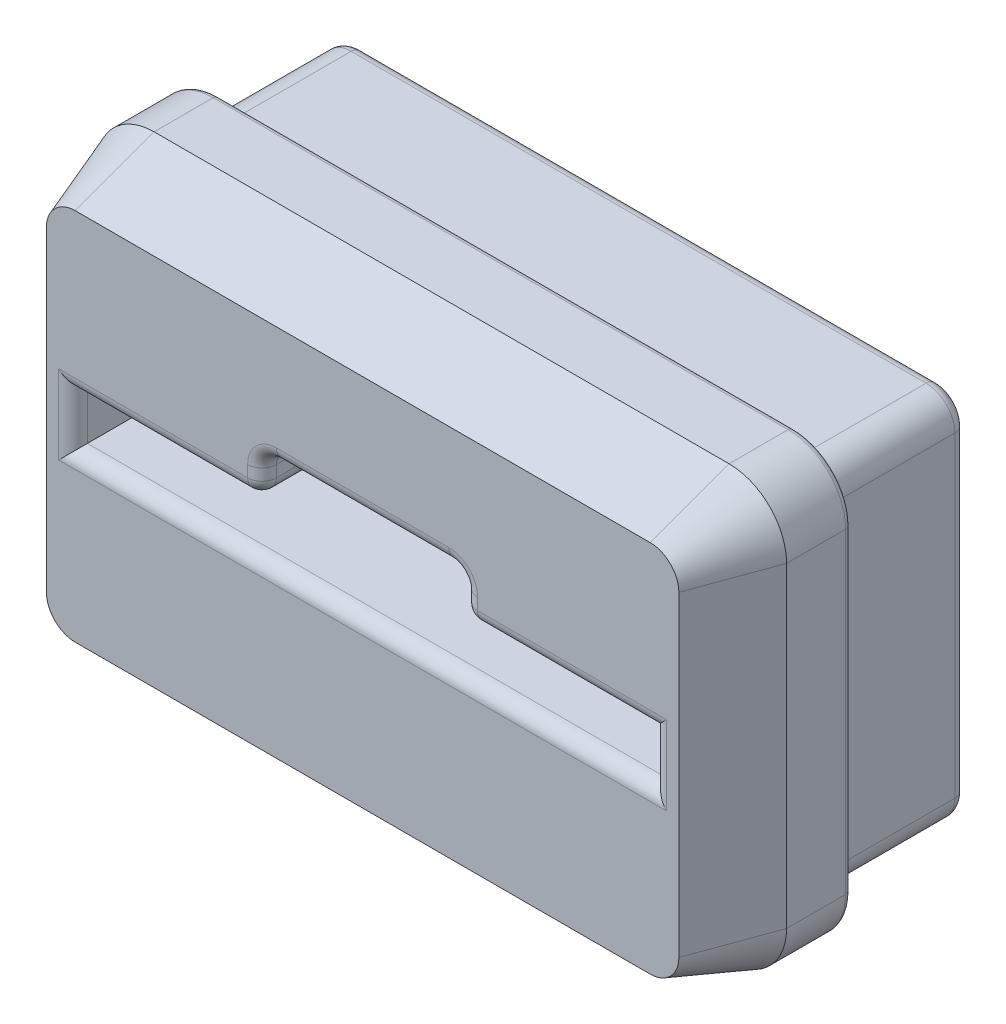
from build123d import *

# Parameters (mm, degrees)
SKETCH1_W           = 24
SKETCH1_H           = 13
BOSS_EXTRUDE1_DEPTH = 15
SKETCH2_W           = 20.15
SKETCH2_H           = 1.75
CUT_EXTRUDE1_DEPTH  = 15
FILLET1_R           = 2
CHAMFER2_SIZE       = 1
CHAMFER2_SIZE2      = 2.747477419
FILLET2_R           = 0.5
CUT_EXTRUDE4_DEPTH  = 11
SKETCH5_W           = 26.855674208
SKETCH5_H           = 19.307728506
CUT_EXTRUDE5_DEPTH  = 8
CUT_EXTRUDE6_DEPTH  = 11
SKETCH7_W           = 29.982721697
SKETCH7_H           = 21.559004648
CUT_EXTRUDE7_DEPTH  = 3
CHAMFER3_SIZE       = 2
FILLET3_R           = 0.4
FILLET4_R           = 0.2
SKETCH8_W           = 7
SKETCH8_H           = 2.8
CUT_EXTRUDE8_DEPTH  = 21.808652047
FILLET5_R           = 0.5


with BuildPart() as part:
    # Sketch1 → Boss-Extrude1 (new body)
    with BuildSketch(Plane(origin=(0, 0, 0), x_dir=(1, 0, 0), z_dir=(0, 1, 0))):
        Rectangle(SKETCH1_W, SKETCH1_H)
    extrude(amount=BOSS_EXTRUDE1_DEPTH)

    # Sketch2 → Cut-Extrude1 (cut)
    with BuildSketch(Plane.XY.offset(6.5)):
        with Locations((0, 7.575)):
            Rectangle(SKETCH2_W, SKETCH2_H)
    extrude(amount=-CUT_EXTRUDE1_DEPTH, mode=Mode.SUBTRACT)

    # Fillet1
    fillet1_edges = [part.edges().sort_by_distance(p)[0] for p in [
        (-12, 15, 0),
        (12, 15, 0),
        (-12, 0, 0),
        (12, 0, 0),
    ]]
    fillet(fillet1_edges, radius=FILLET1_R)

    # Chamfer2
    chamfer2_edges = [part.edges().sort_by_distance(p)[0] for p in [
        (0, 15, 6.5),
        (12, 7.5, 6.5),
        (0, 0, 6.5),
        (-12, 7.5, 6.5),
        (-11.414213562, 14.414213562, 6.5),
        (-11.414213562, 0.585786438, 6.5),
        (11.414213562, 0.585786438, 6.5),
        (11.414213562, 14.414213562, 6.5),
    ]]
    chamfer2_side = [part.faces().sort_by_distance(p)[0] for p in [
        (11.716980566, 7.5, 6.5),
    ]]
    chamfer(chamfer2_edges, length=CHAMFER2_SIZE, length2=CHAMFER2_SIZE2, reference=chamfer2_side[0])

    # Fillet2
    fillet2_edges = [part.edges().sort_by_distance(p)[0] for p in [
        (10.075, 7.575, 6.5),
        (0, 8.45, 6.5),
        (-10.075, 7.575, 6.5),
        (0, 6.7, 6.5),
    ]]
    fillet(fillet2_edges, radius=FILLET2_R)

    # Sketch4 → Cut-Extrude4 (cut)
    with BuildSketch(Plane(origin=(0, 0, -6.5), x_dir=(-1, 0, 0), z_dir=(0, 0, -1))):
        Polygon((-10.075, 8.45), (-8.575, 8.45), (-8.575, 11.891155889), (8.575, 11.891155889), (8.575, 8.45), (10.075, 8.45), (10.075, 6.7), (-10.075, 6.7), align=None)
    extrude(amount=-CUT_EXTRUDE4_DEPTH, mode=Mode.SUBTRACT)

    # Sketch5 → Cut-Extrude5 (cut)
    with BuildSketch(Plane(origin=(0, 0, -6.5), x_dir=(-1, 0, 0), z_dir=(0, 0, -1))):
        with Locations((-0.083402715, 7.762018115)):
            Rectangle(SKETCH5_W, SKETCH5_H)
        with BuildLine():
            Line((10, 14), (-10, 14))
            ThreePointArc((-10, 14), (-10.707106781, 13.707106781), (-11, 13))
            Line((-11, 13), (-11, 2))
            ThreePointArc((-11, 2), (-10.707106781, 1.292893219), (-10, 1))
            Line((-10, 1), (10, 1))
            ThreePointArc((10, 1), (10.707106781, 1.292893219), (11, 2))
            Line((11, 2), (11, 13))
            ThreePointArc((11, 13), (10.707106781, 13.707106781), (10, 14))
        make_face(mode=Mode.SUBTRACT)
    extrude(amount=-CUT_EXTRUDE5_DEPTH, mode=Mode.SUBTRACT)

    # Sketch6 → Cut-Extrude6 (cut)
    with BuildSketch(Plane(origin=(0, 0, -6.5), x_dir=(-1, 0, 0), z_dir=(0, 0, -1))):
        with BuildLine():
            Line((-9, 5.7), (9, 5.7))
            ThreePointArc((9, 5.7), (9.707106781, 5.407106781), (10, 4.7))
            Line((10, 4.7), (10, 3))
            ThreePointArc((10, 3), (9.707106781, 2.292893219), (9, 2))
            Line((9, 2), (-9, 2))
            ThreePointArc((-9, 2), (-9.707106781, 2.292893219), (-10, 3))
            Line((-10, 3), (-10, 4.7))
            ThreePointArc((-10, 4.7), (-9.707106781, 5.407106781), (-9, 5.7))
        make_face()
    extrude(amount=-CUT_EXTRUDE6_DEPTH, mode=Mode.SUBTRACT)

    # Sketch7 → Cut-Extrude7 (cut)
    with BuildSketch(Plane(origin=(0, 0, -6.5), x_dir=(-1, 0, 0), z_dir=(0, 0, -1))):
        with Locations((0.615824589, 7.279559508)):
            Rectangle(SKETCH7_W, SKETCH7_H)
    extrude(amount=-CUT_EXTRUDE7_DEPTH, mode=Mode.SUBTRACT)

    # Chamfer3
    chamfer3_edges = [part.edges().sort_by_distance(p)[0] for p in [
        (9.325, 8.45, -3.5),
        (-9.325, 8.45, -3.5),
    ]]
    chamfer(chamfer3_edges, length=CHAMFER3_SIZE)

    # Fillet3
    fillet3_edges = [part.edges().sort_by_distance(p)[0] for p in [
        (-10, 3.85, -3.5),
        (0, 14, -3.5),
        (-10.707106781, 13.707106781, -3.5),
        (-11, 7.5, -3.5),
        (-10.707106781, 1.292893219, -3.5),
        (0, 1, -3.5),
        (10.707106781, 1.292893219, -3.5),
        (11, 7.5, -3.5),
        (10.707106781, 13.707106781, -3.5),
        (0, 6.7, -3.5),
        (0, 11.891155889, -3.5),
        (-8.575, 11.170577944, -3.5),
        (-9.707106781, 2.292893219, -3.5),
        (0, 2, -3.5),
        (9.707106781, 2.292893219, -3.5),
        (10, 3.85, -3.5),
        (9.707106781, 5.407106781, -3.5),
        (0, 5.7, -3.5),
        (-9.707106781, 5.407106781, -3.5),
        (8.575, 11.170577944, -3.5),
        (-9.325, 10.45, -3.5),
        (9.325, 10.45, -3.5),
    ]]
    fillet(fillet3_edges, radius=FILLET3_R)

    # Fillet4
    fillet4_edges = [part.edges().sort_by_distance(p)[0] for p in [
        (-11.414213562, 14.414213562, 1.5),
        (0, 0, 1.5),
        (-12, 7.5, 1.5),
        (12, 7.5, 1.5),
        (11.414213562, 0.585786438, 1.5),
        (11.414213562, 14.414213562, 1.5),
        (0, 15, 1.5),
        (-11.414213562, 0.585786438, 1.5),
    ]]
    fillet(fillet4_edges, radius=FILLET4_R)

    # Sketch8 → Cut-Extrude8 (cut, through all)
    with BuildSketch(Plane(origin=(0, 0, 4.5), x_dir=(-1, 0, 0), z_dir=(0, 0, -1))):
        with Locations((0, 8.45)):
            Rectangle(SKETCH8_W, SKETCH8_H)
    extrude(amount=-CUT_EXTRUDE8_DEPTH, mode=Mode.SUBTRACT)

    # Fillet5
    fillet5_edges = [part.edges().sort_by_distance(p)[0] for p in [
        (-3.5, 8.45, 5.25),
        (-3.5, 9.4, 6.5),
        (-3.5, 9.85, 5.5),
        (3.5, 8.45, 5.25),
        (3.5, 9.4, 6.5),
        (-3.5, 8.596446609, 6.353553391),
        (3.5, 8.596446609, 6.353553391),
        (0, 9.85, 6.5),
        (3.5, 9.85, 5.5),
    ]]
    fillet(fillet5_edges, radius=FILLET5_R)


solid = part.part
